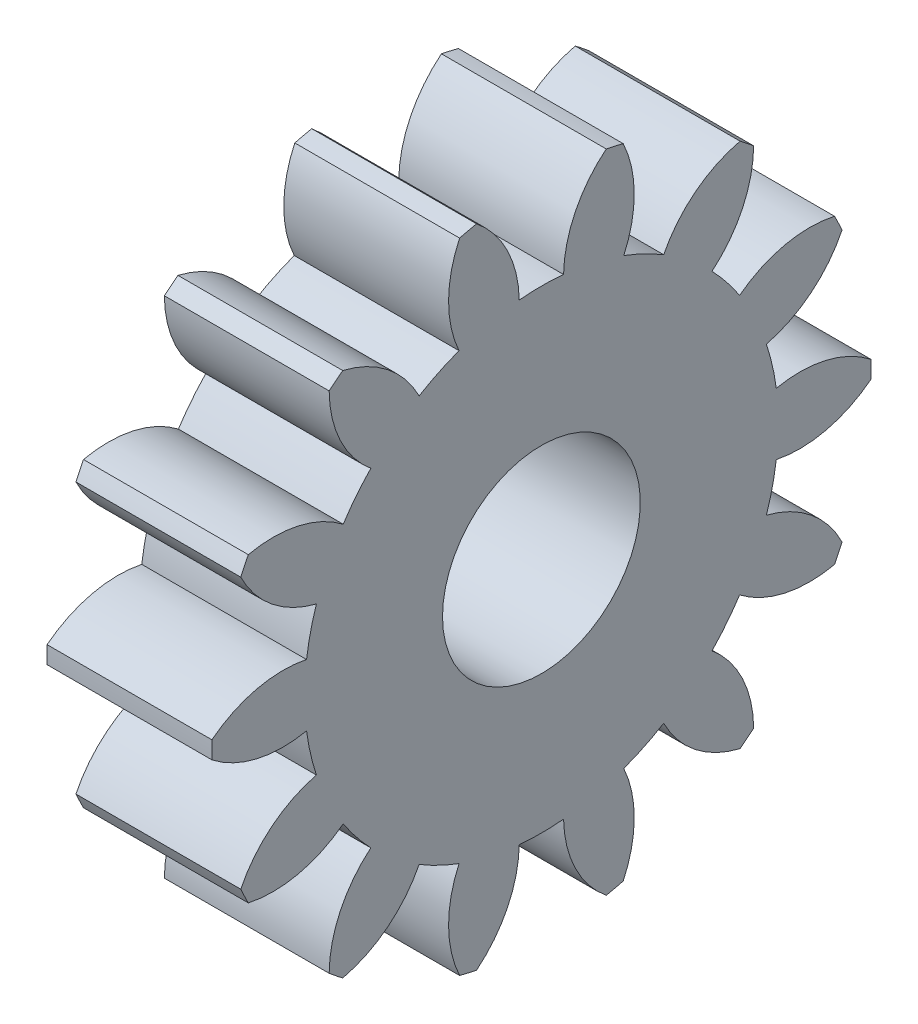
from build123d import *

# Parameters (mm, degrees)
BASPROSKE_W     = 5
BASPROSKE_H     = 10
TOOTHCUT_DEPTH  = 16
TEETHCUTS_COUNT = 14
TEETHCUTS_ANGLE = 334.285714286
BORSKE_R        = 3
BORE_DEPTH      = 50.0000508


with BuildPart() as part:
    # BasProSke → Base-Revolve (revolve)
    with BuildSketch(Plane(origin=(0, 0, 0), x_dir=(1, 0, 0), z_dir=(0, 1, 0)), mode=Mode.PRIVATE) as base_revolve_sk:
        with Locations((2.5, 5)):
            Rectangle(BASPROSKE_W, BASPROSKE_H)
    revolve(base_revolve_sk.sketch.rotate(Axis((-10, 0, 0), (1, 0, 0)), 180), axis=Axis((-10, 0, 0), (1, 0, 0)))

    # TooCutSke → ToothCut (cut, through all)
    with BuildSketch(Plane(origin=(0, 0, 0), x_dir=(0, 0, -1), z_dir=(1, 0, 0))):
        with BuildLine():
            ThreePointArc((0.671900202, 7.155021479), (0, 7.1865), (-0.671900202, 7.155021479))
            ThreePointArc((-0.671900202, 7.155021479), (-1.034144542, 8.637744921), (-1.992992839, 9.825305324))
            ThreePointArc((-1.992992839, 9.825305324), (0, 10.0254), (1.992992839, 9.825305324))
            ThreePointArc((1.992992839, 9.825305324), (1.034144542, 8.637744921), (0.671900202, 7.155021479))
        make_face()
    toothcut = extrude(amount=TOOTHCUT_DEPTH, mode=Mode.SUBTRACT)

    # TeethCuts: ToothCut ×14 about axis
    teethcuts_axis = Axis((-10, 0, 0), (1, 0, 0))
    for i in range(1, TEETHCUTS_COUNT):
        add(toothcut.rotate(teethcuts_axis, i * TEETHCUTS_ANGLE / (TEETHCUTS_COUNT - 1)), mode=Mode.SUBTRACT)

    # BorSke → Bore (cut, symmetric)
    with BuildSketch(Plane(origin=(0, 0, 0), x_dir=(0, 0, -1), z_dir=(1, 0, 0))):
        with Locations(Location((0, 0, 0), (0, 0, 180))):
            Circle(BORSKE_R)
    extrude(amount=BORE_DEPTH, both=True, mode=Mode.SUBTRACT)


solid = part.part
